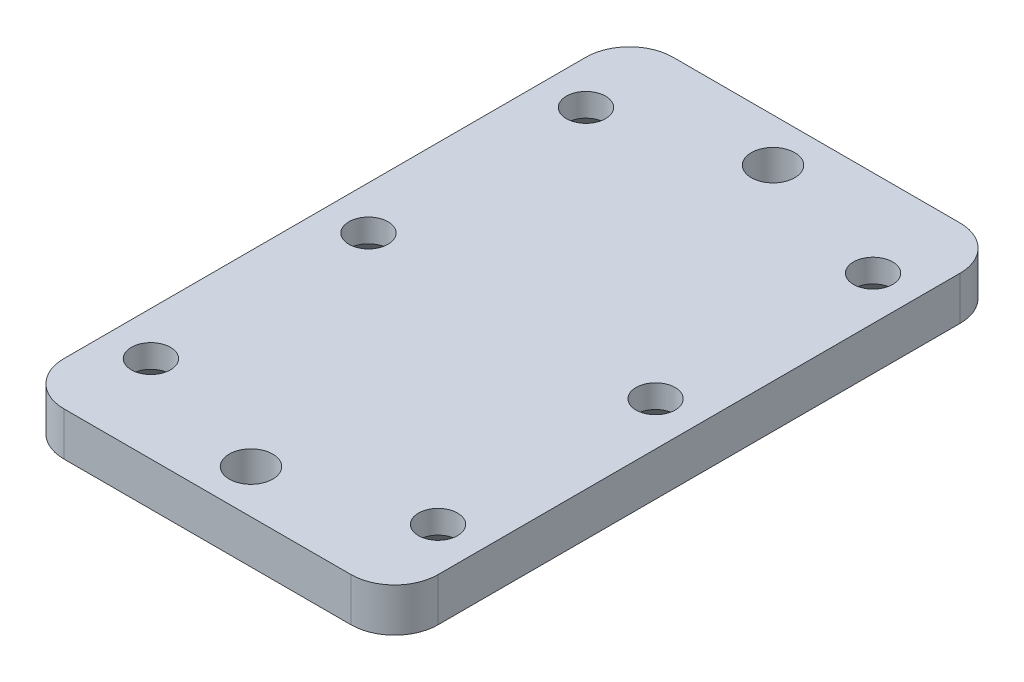
from build123d import *

# Parameters (mm, degrees)
SKETCH_2_R                  = 2.2
EXTRUDE_1_DEPTH             = 5
SKETCH_3_R                  = 2
CUT_EXTRUDE_1_DEPTH         = 50
HOLE_WIZARD_M61_D           = 5
HOLE_WIZARD_M61_CSINK_D     = 7
HOLE_WIZARD_M61_CSINK_ANGLE = 90
HOLE_WIZARD_M41_D           = 4.5
HOLE_WIZARD_M41_CSINK_D     = 9.18
HOLE_WIZARD_M41_CSINK_ANGLE = 90


with BuildPart() as part:
    # Эскиз2 → Бобышка-Вытянуть1 (new body)
    with BuildSketch(Plane(origin=(0, 0, 0), x_dir=(1, 0, 0), z_dir=(0, 1, 0))):
        with BuildLine():
            Line((-16.5, -35), (16.5, -35))
            ThreePointArc((16.5, -35), (20.035533906, -33.535533906), (21.5, -30))
            Line((21.5, -30), (21.5, 30))
            ThreePointArc((21.5, 30), (20.035533906, 33.535533906), (16.5, 35))
            Line((16.5, 35), (-16.5, 35))
            ThreePointArc((-16.5, 35), (-20.035533906, 33.535533906), (-21.5, 30))
            Line((-21.5, 30), (-21.5, -30))
            ThreePointArc((-21.5, -30), (-20.035533906, -33.535533906), (-16.5, -35))
        make_face()
        with Locations(Location((-16.5, -25, 0), (0, 0, 270))):
            Circle(SKETCH_2_R, mode=Mode.SUBTRACT)
        with Locations(Location((-16.5, 0, 0), (0, 0, 270))):
            Circle(SKETCH_2_R, mode=Mode.SUBTRACT)
        with Locations(Location((-16.5, 25, 0), (0, 0, 270))):
            Circle(SKETCH_2_R, mode=Mode.SUBTRACT)
        with Locations(Location((16.5, 0, 0), (0, 0, 90))):
            Circle(SKETCH_2_R, mode=Mode.SUBTRACT)
        with Locations(Location((16.5, 25, 0), (0, 0, 90))):
            Circle(SKETCH_2_R, mode=Mode.SUBTRACT)
        with Locations(Location((16.5, -25, 0), (0, 0, 90))):
            Circle(SKETCH_2_R, mode=Mode.SUBTRACT)
    extrude(amount=EXTRUDE_1_DEPTH)

    # Эскиз3 → Вырез-Вытянуть1 (cut)
    with BuildSketch(Plane(origin=(0, 5, 0), x_dir=(1, 0, 0), z_dir=(0, 1, 0))):
        with Locations(Location((0, 30, 0), (0, 0, 270))):
            Circle(SKETCH_3_R)
        with Locations(Location((0, -30, 0), (0, 0, 270))):
            Circle(SKETCH_3_R)
    extrude(amount=-CUT_EXTRUDE_1_DEPTH, mode=Mode.SUBTRACT)

    # Отверстие обработанное метчиком M61 (through all)
    with Locations(Plane.XZ):
        with Locations((0, -30), (0, 30)):
            CounterSinkHole(HOLE_WIZARD_M61_D / 2, HOLE_WIZARD_M61_CSINK_D / 2, counter_sink_angle=HOLE_WIZARD_M61_CSINK_ANGLE)

    # Зенковка для винта с потайной головкой и внутренним шестигранником M41 (through all)
    with Locations(Plane.XZ):
        with Locations((16.5, -25), (16.5, 0), (16.5, 25), (-16.5, 25), (-16.5, 0), (-16.5, -25)):
            CounterSinkHole(HOLE_WIZARD_M41_D / 2, HOLE_WIZARD_M41_CSINK_D / 2, counter_sink_angle=HOLE_WIZARD_M41_CSINK_ANGLE)


solid = part.part
